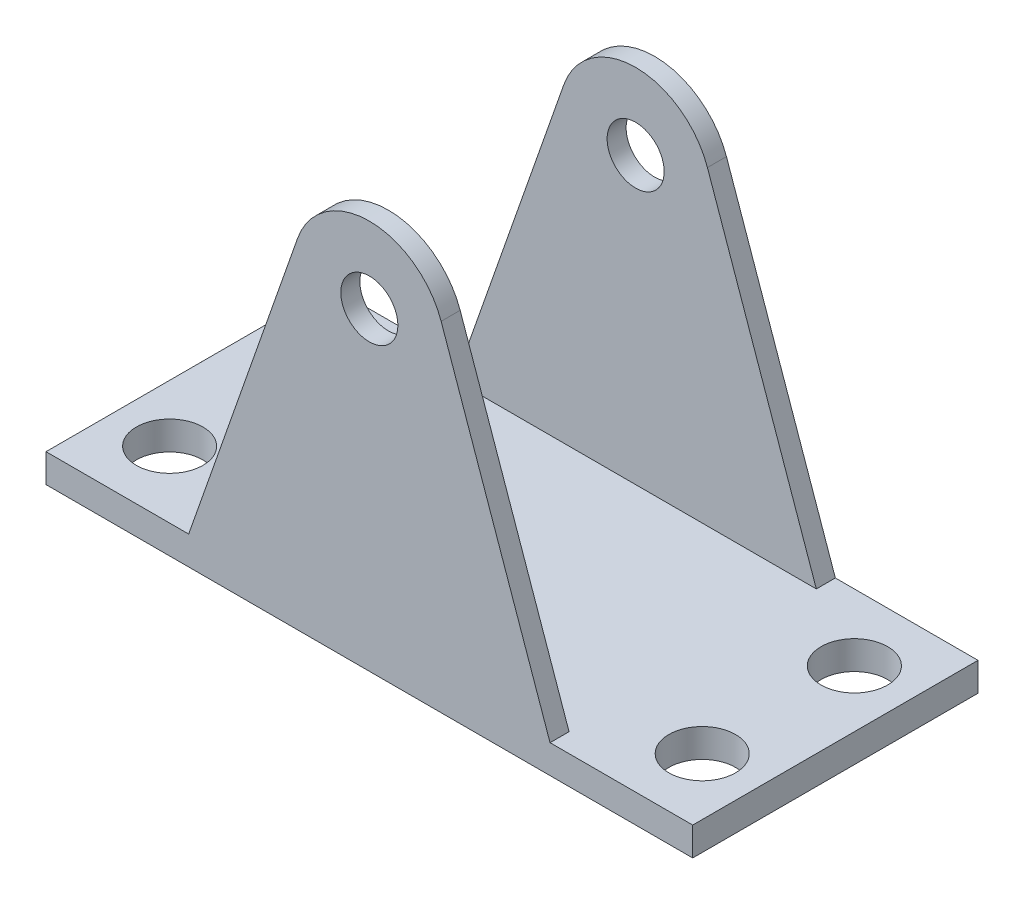
from build123d import *

# Parameters (mm, degrees)
SKETCH_1_W          = 68
SKETCH_1_H          = 30
EXTRUDE_1_DEPTH     = 3
SKETCH_2_R          = 3
EXTRUDE_2_DEPTH     = 2
EXTRUDE_START       = -28
SKETCH_2_2_R        = 3
EXTRUDE_3_DEPTH     = 2
SKETCH_3_R          = 3.5
CUT_EXTRUDE_1_DEPTH = 12


with BuildPart() as part:
    # 草图1 → 凸台-拉伸1 (new body)
    with BuildSketch(Plane(origin=(0, 0, 0), x_dir=(1, 0, 0), z_dir=(0, 1, 0))):
        with Locations((34, 15)):
            Rectangle(SKETCH_1_W, SKETCH_1_H)
    extrude(amount=EXTRUDE_1_DEPTH)

    # 草图2 → 凸台-拉伸2 (add)
    with BuildSketch(Plane.XY):
        with BuildLine():
            Line((15, 3), (26.450876235, 35.647778385))
            ThreePointArc((26.450876235, 35.647778385), (34, 41), (41.549123765, 35.647778385))
            Line((41.549123765, 35.647778385), (53, 3))
            Line((53, 3), (15, 3))
        make_face()
        with Locations((34, 33)):
            Circle(SKETCH_2_R, mode=Mode.SUBTRACT)
    extrude(amount=-EXTRUDE_2_DEPTH)

    # 草图2<2> → 凸台-拉伸3 (add)
    with BuildSketch(Plane.XY.offset(EXTRUDE_START)):
        with BuildLine():
            Line((15, 3), (26.450876235, 35.647778385))
            ThreePointArc((26.450876235, 35.647778385), (34, 41), (41.549123765, 35.647778385))
            Line((41.549123765, 35.647778385), (53, 3))
            Line((53, 3), (15, 3))
        make_face()
        with Locations((34, 33)):
            Circle(SKETCH_2_2_R, mode=Mode.SUBTRACT)
    extrude(amount=-EXTRUDE_3_DEPTH)

    # 草图3 → 切除-拉伸1 (cut)
    with BuildSketch(Plane.XZ):
        with Locations(Location((6, -7, 0), (0, 0, 270))):
            Circle(SKETCH_3_R)
        with Locations(Location((6, -23, 0), (0, 0, 270))):
            Circle(SKETCH_3_R)
        with Locations(Location((62, -7, 0), (0, 0, 270))):
            Circle(SKETCH_3_R)
        with Locations(Location((62, -23, 0), (0, 0, 270))):
            Circle(SKETCH_3_R)
    extrude(amount=-CUT_EXTRUDE_1_DEPTH, mode=Mode.SUBTRACT)


solid = part.part
